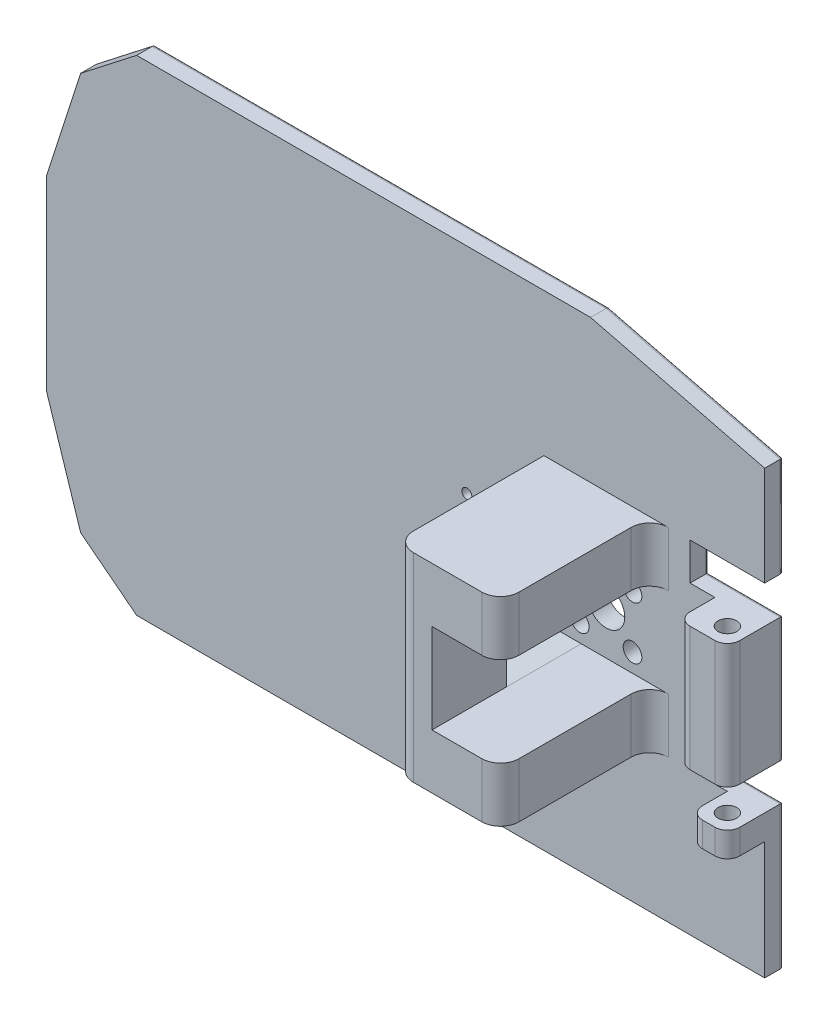
from build123d import *

# Parameters (mm, degrees)
BOSS_EXTRUDE1_DEPTH     = 3
FILLET1_R               = 0.5
BOSS_EXTRUDE3_DEPTH     = 24
FILLET4_R               = 3
FILLET5_R               = 3
FILLET6_R               = 3
SKETCH4_W               = 6
SKETCH4_H               = 4
BOSS_EXTRUDE4_DEPTH     = 6
FILLET7_R               = 2
SKETCH7_W               = 8
SKETCH7_H               = 20
BOSS_EXTRUDE5_DEPTH     = 6
FILLET8_R               = 2
CUT_EXTRUDE1_DEPTH      = 31.137490822
CUT_EXTRUDE1_DEPTH_BACK = 7.874
SKETCH5_R               = 1.5
CUT_EXTRUDE2_DEPTH      = 31.137490822
SKETCH12_R              = 3
SKETCH12_R_2            = 2.5
CUT_EXTRUDE3_DEPTH      = 31.137490822
SKETCH13_R              = 1.5
CUT_EXTRUDE4_DEPTH      = 31.137490822
CIRPATTERN1_COUNT       = 4
SKETCH14_R              = 0.8
CUT_EXTRUDE5_DEPTH      = 31.137490822


with BuildPart() as part:
    # Sketch1 → Boss-Extrude1 (new body)
    with BuildSketch(Plane.XY):
        Polygon((-18.861888764, -42.099818659), (82.138111236, -42.099818659), (82.138111236, -19.099818659), (70.138111236, -19.099818659), (70.138111236, -13.099818659), (82.138111236, -13.099818659), (82.138111236, 6.900181341), (70.138111236, 6.900181341), (70.138111236, 12.900181341), (82.138111236, 12.900181341), (82.138111236, 28.900181341), (54.138111236, 35.900181341), (-18.861888764, 35.900181341), (-27.861888764, 28.900181341), (-33.361888764, 11.900181341), (-33.361888764, -18.099818659), (-27.861888764, -35.099818659), align=None)
    extrude(amount=BOSS_EXTRUDE1_DEPTH)

    # Fillet1
    fillet1_edges = [part.edges().sort_by_distance(p)[0] for p in [
        (-30.611888764, -26.599818659, 0),
        (-33.361888764, -3.099818659, 0),
        (-30.611888764, 20.400181341, 0),
        (-23.361888764, 32.400181341, 0),
        (17.638111236, 35.900181341, 0),
        (68.138111236, 32.400181341, 0),
        (82.138111236, 20.900181341, 0),
        (76.138111236, 12.900181341, 0),
        (70.138111236, 9.900181341, 0),
        (76.138111236, 6.900181341, 0),
        (82.138111236, -3.099818659, 0),
        (76.138111236, -13.099818659, 0),
        (70.138111236, -16.099818659, 0),
        (76.138111236, -19.099818659, 0),
        (82.138111236, -30.599818659, 0),
        (31.638111236, -42.099818659, 0),
        (-23.361888764, -38.599818659, 0),
    ]]
    fillet(fillet1_edges, radius=FILLET1_R)

    # Sketch2 → Boss-Extrude3 (add)
    with BuildSketch(Plane.XY.offset(3)):
        Polygon((63.638111236, -19.099818659), (46.638111236, -19.099818659), (46.638111236, 12.900181341), (63.638111236, 12.900181341), (63.638111236, 4.100181341), (52.638111236, 4.100181341), (52.638111236, -10.299818659), (63.638111236, -10.299818659), align=None)
    extrude(amount=BOSS_EXTRUDE3_DEPTH)

    # Fillet4
    fillet4_edges = [part.edges().sort_by_distance(p)[0] for p in [
        (46.638111236, -3.099818659, 27),
    ]]
    fillet(fillet4_edges, radius=FILLET4_R)

    # Fillet5
    fillet5_edges = [part.edges().sort_by_distance(p)[0] for p in [
        (63.638111236, 8.500181341, 27),
        (63.638111236, -14.699818659, 27),
    ]]
    fillet(fillet5_edges, radius=FILLET5_R)

    # Fillet6
    fillet6_edges = [part.edges().sort_by_distance(p)[0] for p in [
        (63.638111236, -14.699818659, 3),
        (63.638111236, 8.500181341, 3),
    ]]
    fillet(fillet6_edges, radius=FILLET6_R)

    # Sketch4 → Boss-Extrude4 (add)
    with BuildSketch(Plane.XY.offset(3)):
        with Locations((79.138111236, -21.099818659)):
            Rectangle(SKETCH4_W, SKETCH4_H)
    extrude(amount=BOSS_EXTRUDE4_DEPTH)

    # Fillet7
    fillet7_edges = [part.edges().sort_by_distance(p)[0] for p in [
        (82.138111236, -21.099818659, 9),
        (76.138111236, -21.099818659, 9),
    ]]
    fillet(fillet7_edges, radius=FILLET7_R)

    # Sketch7 → Boss-Extrude5 (add)
    with BuildSketch(Plane.XY.offset(3)):
        with Locations((78.138111236, -3.099818659)):
            Rectangle(SKETCH7_W, SKETCH7_H)
    extrude(amount=BOSS_EXTRUDE5_DEPTH)

    # Fillet8
    fillet8_edges = [part.edges().sort_by_distance(p)[0] for p in [
        (82.138111236, -3.099818659, 9),
        (74.138111236, -3.099818659, 9),
    ]]
    fillet(fillet8_edges, radius=FILLET8_R)

    # Sketch5 → Cut-Extrude1 (cut, two sides: drawn at the far end of the back side and taken through both)
    with BuildSketch(Plane(origin=(0, -19.099818659, 0), x_dir=(1, 0, 0), z_dir=(0, 1, 0)).offset(-CUT_EXTRUDE1_DEPTH_BACK)):
        with Locations(Location((79.138111236, -6, 0), (0, 0, 90))):
            Circle(SKETCH5_R)
    extrude(amount=CUT_EXTRUDE1_DEPTH + CUT_EXTRUDE1_DEPTH_BACK, mode=Mode.SUBTRACT)

    # Sketch11 → Cut-Extrude2 (cut)
    with BuildSketch(Plane(origin=(52.638111236, 0, 0), x_dir=(0, 0, -1), z_dir=(1, 0, 0))):
        Polygon((-3, 4.100181341), (-15, 4.100181341), (-15, -10.382699653), (-3, -10.299818659), align=None)
    extrude(amount=-CUT_EXTRUDE2_DEPTH, mode=Mode.SUBTRACT)

    # Sketch12 → Cut-Extrude3 (cut)
    with BuildSketch(Plane.XY.offset(3)):
        with Locations((56.638111236, -3.099818659)):
            Circle(SKETCH12_R)
        with Locations((34.238111236, -3.099818659)):
            Circle(SKETCH12_R_2)
    extrude(amount=-CUT_EXTRUDE3_DEPTH, mode=Mode.SUBTRACT)

    # Sketch13 → Cut-Extrude4 (cut)
    with BuildSketch(Plane.XY.offset(3)):
        with Locations((60.880751923, 1.142822028)):
            Circle(SKETCH13_R)
    cut_extrude4 = extrude(amount=-CUT_EXTRUDE4_DEPTH, mode=Mode.SUBTRACT)

    # CirPattern1: Cut-Extrude4 ×4 about axis
    cirpattern1_axis = Axis((56.638111236, -3.099818659, 0), (0, 0, 1))
    for i in range(1, CIRPATTERN1_COUNT):
        add(cut_extrude4.rotate(cirpattern1_axis, i * 360 / CIRPATTERN1_COUNT), mode=Mode.SUBTRACT)

    # Sketch14 → Cut-Extrude5 (cut)
    with BuildSketch(Plane.XY.offset(3)):
        with Locations((34.238111236, 1.400181341)):
            Circle(SKETCH14_R)
        with Locations((34.238111236, -7.599818659)):
            Circle(SKETCH14_R)
    extrude(amount=-CUT_EXTRUDE5_DEPTH, mode=Mode.SUBTRACT)


solid = part.part
